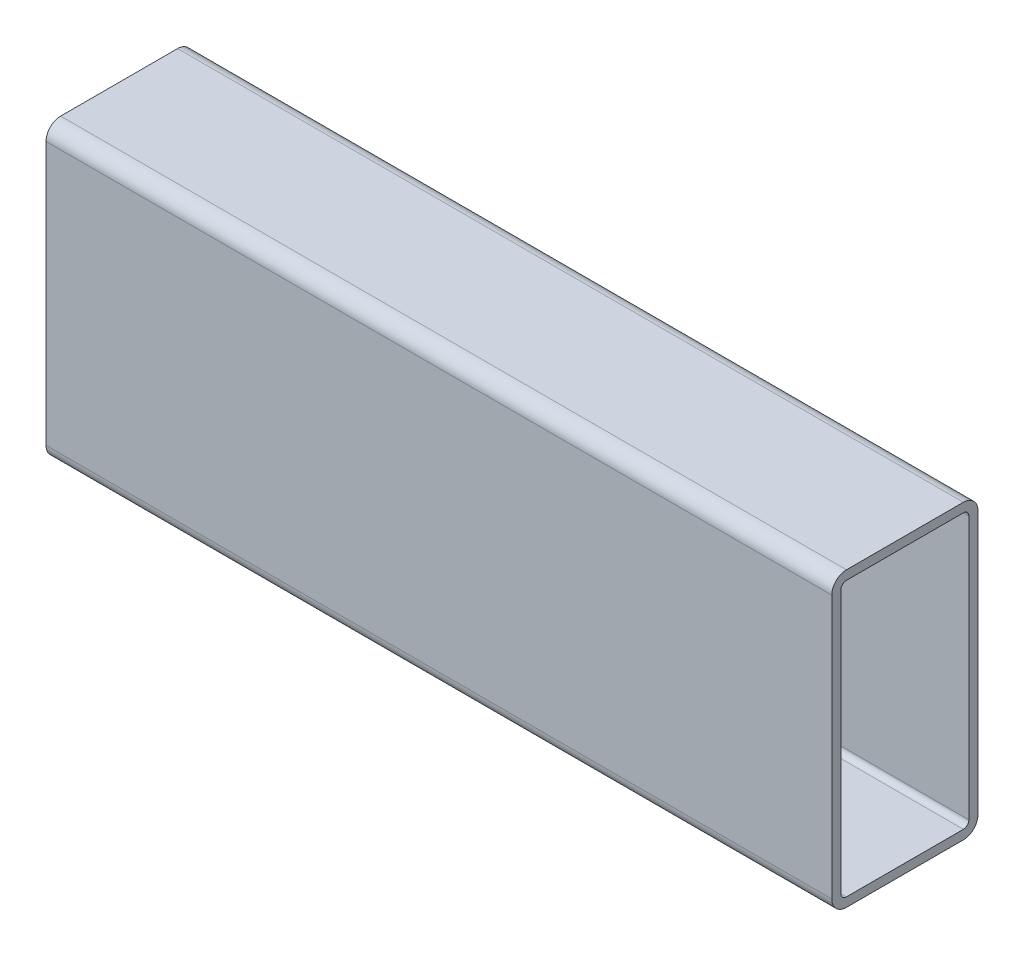
from build123d import *

# Parameters (mm, degrees)
EXTRUDE_THIN1_DEPTH = 68.2625


with BuildPart() as part:
    # Sketch1 → Extrude-Thin1 (new, symmetric)
    with BuildSketch(Plane(origin=(0, 0, 0), x_dir=(0, 0, -1), z_dir=(1, 0, 0))):
        with BuildLine():
            Line((-12.7, 22.86), (-12.7, -22.86))
            ThreePointArc((-12.7, -22.86), (-11.956051224, -24.656051224), (-10.16, -25.4))
            Line((-10.16, -25.4), (10.16, -25.4))
            ThreePointArc((10.16, -25.4), (11.956051224, -24.656051224), (12.7, -22.86))
            Line((12.7, -22.86), (12.7, 22.86))
            ThreePointArc((12.7, 22.86), (11.956051224, 24.656051224), (10.16, 25.4))
            Line((10.16, 25.4), (-10.16, 25.4))
            ThreePointArc((-10.16, 25.4), (-11.956051224, 24.656051224), (-12.7, 22.86))
        make_face()
        with BuildLine():
            Line((-11.1125, 22.86), (-11.1125, -22.86))
            ThreePointArc((-11.1125, -22.86), (-10.833519209, -23.533519209), (-10.16, -23.8125))
            Line((-10.16, -23.8125), (10.16, -23.8125))
            ThreePointArc((10.16, -23.8125), (10.833519209, -23.533519209), (11.1125, -22.86))
            Line((11.1125, -22.86), (11.1125, 22.86))
            ThreePointArc((11.1125, 22.86), (10.833519209, 23.533519209), (10.16, 23.8125))
            Line((10.16, 23.8125), (-10.16, 23.8125))
            ThreePointArc((-10.16, 23.8125), (-10.833519209, 23.533519209), (-11.1125, 22.86))
        make_face(mode=Mode.SUBTRACT)
    extrude(amount=EXTRUDE_THIN1_DEPTH, both=True)


solid = part.part
